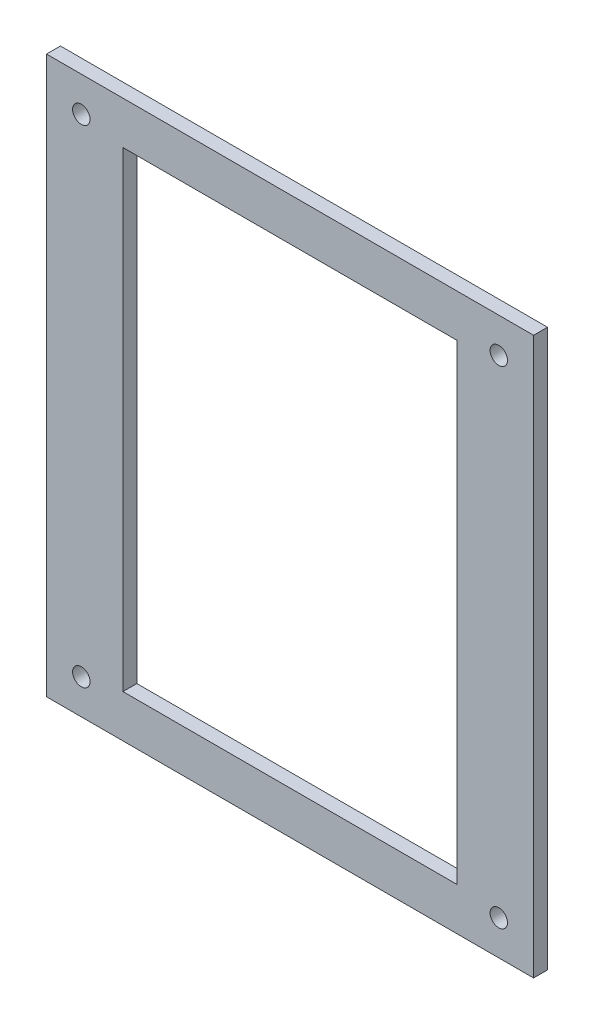
from build123d import *

# Parameters (mm, degrees)
SKETCH1_W           = 88.9
SKETCH1_H           = 101.6
SKETCH1_R           = 1.59
SKETCH1_W_2         = 61
SKETCH1_H_2         = 86
BOSS_EXTRUDE1_DEPTH = 2.54


with BuildPart() as part:
    # Sketch1 → Boss-Extrude1 (new body)
    with BuildSketch(Plane.XY):
        with Locations((44.45, -50.8)):
            Rectangle(SKETCH1_W, SKETCH1_H)
        with Locations((6.35, -6.35)):
            Circle(SKETCH1_R, mode=Mode.SUBTRACT)
        with Locations((82.55, -6.35)):
            Circle(SKETCH1_R, mode=Mode.SUBTRACT)
        with Locations((6.35, -95.25)):
            Circle(SKETCH1_R, mode=Mode.SUBTRACT)
        with Locations((82.55, -95.25)):
            Circle(SKETCH1_R, mode=Mode.SUBTRACT)
        with Locations((44.45, -50.8)):
            Rectangle(SKETCH1_W_2, SKETCH1_H_2, mode=Mode.SUBTRACT)
    extrude(amount=BOSS_EXTRUDE1_DEPTH)


solid = part.part
